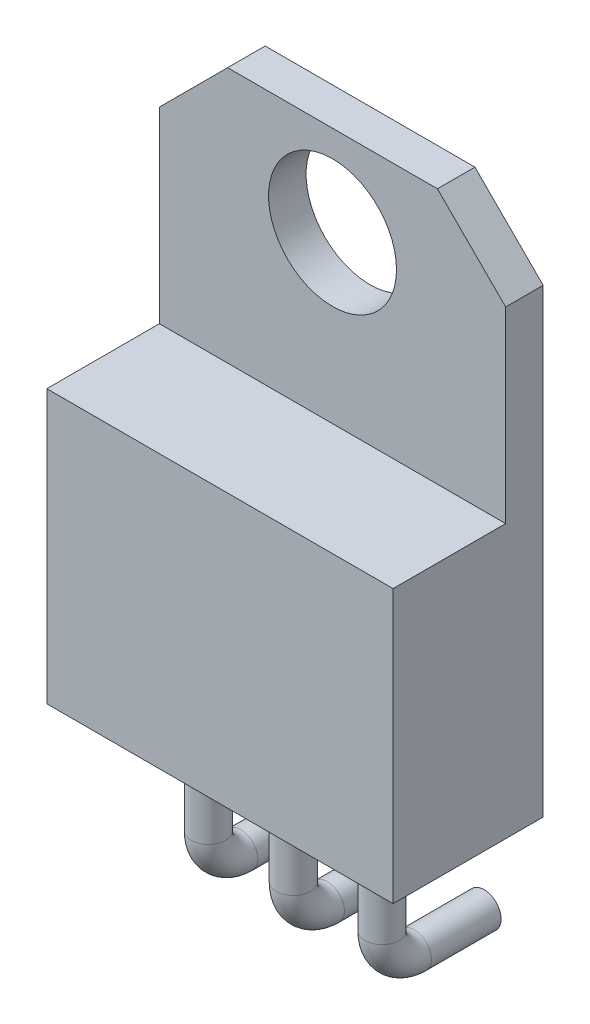
from build123d import *

# Parameters (mm, degrees)
ESQUISSE1_W             = 10.15
ESQUISSE1_H             = 15.5
EXTRUSION1_DEPTH        = 1.1
ESQUISSE2_R             = 1.875
ENL_V_MAT_EXTRU_1_DEPTH = 19.560239761
CHANFREIN1_SIZE         = 2
ESQUISSE3_W             = 10.15
ESQUISSE3_H             = 8
EXTRUSION2_DEPTH        = 3.3
ESQUISSE5_R             = 0.5
ESQUISSE9_R             = 0.5


with BuildPart() as part:
    # Esquisse1 → Extrusion1 (new body)
    with BuildSketch(Plane.XY):
        with Locations((5.075, 7.75)):
            Rectangle(ESQUISSE1_W, ESQUISSE1_H)
    extrude(amount=EXTRUSION1_DEPTH)

    # Esquisse2 → Enlèv. mat.-Extru.1 (cut, through all)
    with BuildSketch(Plane.XY.offset(1.1)):
        with Locations((5.075, 12.85)):
            Circle(ESQUISSE2_R)
    extrude(amount=-ENL_V_MAT_EXTRU_1_DEPTH, mode=Mode.SUBTRACT)

    # Chanfrein1
    chanfrein1_edges = [part.edges().sort_by_distance(p)[0] for p in [
        (0, 15.5, 0.55),
        (10.15, 15.5, 0.55),
    ]]
    chamfer(chanfrein1_edges, length=CHANFREIN1_SIZE)

    # Esquisse3 → Extrusion2 (add)
    with BuildSketch(Plane.XY.offset(1.1)):
        with Locations((5.075, 4)):
            Rectangle(ESQUISSE3_W, ESQUISSE3_H)
    extrude(amount=EXTRUSION2_DEPTH)

    # Balayage1: sweep along a path in Esquisse8
    with BuildLine(Plane(origin=(2.54, 0, 0), x_dir=(0, 0, -1), z_dir=(1, 0, 0))) as balayage1_path:
        Line((-2.25, 0), (-2.25, -3.05))
        ThreePointArc((-2.25, -3.05), (-1.957106781, -3.757106781), (-1.25, -4.05))
        Line((-1.25, -4.05), (0.791981695, -4.05))
    # Esquisse5 → Balayage1 (sweep)
    with BuildSketch(Plane.XZ):
        with Locations((2.535, 2.2)):
            Circle(ESQUISSE5_R)
    balayage1 = sweep(path=balayage1_path.line)

    # Balayage2: sweep along a path in Esquisse10
    with BuildLine(Plane(origin=(5.08, 0, 0), x_dir=(0, 0, -1), z_dir=(1, 0, 0))) as balayage2_path:
        Line((-2.25, 0), (-2.25, -3.05))
        ThreePointArc((-2.25, -3.05), (-1.957106781, -3.757106781), (-1.25, -4.05))
        Line((-1.25, -4.05), (0.791981695, -4.05))
    # Esquisse9 → Balayage2 (sweep)
    with BuildSketch(Plane.XZ):
        with Locations((5.075, 2.25)):
            Circle(ESQUISSE9_R)
    sweep(path=balayage2_path.line)

    # Symétrie1: Balayage1 across plane
    add(balayage1.mirror(Plane(origin=(5.08, 0, 0), x_dir=(0, 0, 1), z_dir=(1, 0, 0))))


solid = part.part
